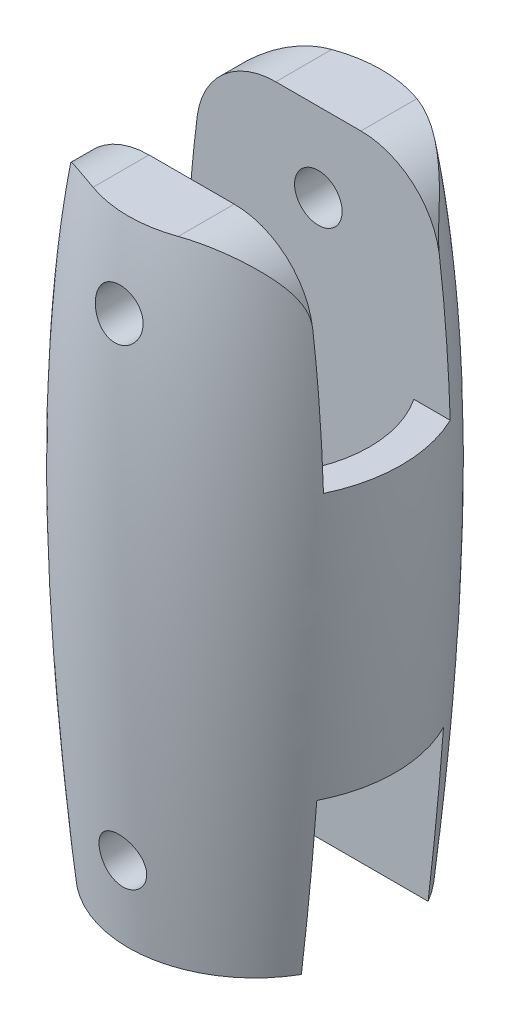
from build123d import *

# Parameters (mm, degrees)
CUT_EXTRUDE1_DEPTH      = 24.938835821
CUT_EXTRUDE1_DEPTH_BACK = 24.938835821
SKETCH2_W               = 8
SKETCH2_H               = 13
SKETCH2_H_2             = 10
CUT_EXTRUDE2_DEPTH      = 24.938835821
CUT_EXTRUDE2_DEPTH_BACK = 24.938835821
SKETCH3_R               = 1.5
CUT_EXTRUDE3_DEPTH      = 31.03444459
CUT_EXTRUDE4_START      = 10
CUT_EXTRUDE4_DEPTH      = 20


with BuildPart() as part:
    # Sketch1 → Revolve1 (revolve)
    with BuildSketch(Plane(origin=(0, 0, 0), x_dir=(0, 0, -1), z_dir=(1, 0, 0))):
        with BuildLine():
            Line((0, 20), (0, -20))
            Line((0, -20), (8, -20))
            add(Edge.make_bspline(
                [(8, 20), (10.604722665, 5.227883705), (8, -20)],
                knots=[0, 0, 0, 1, 1, 1], degree=2))
            Line((8, 20), (0, 20))
        make_face()
    revolve(axis=Axis((0, 20, 0), (0, -1, 0)))

    # Sketch2 → Cut-Extrude1 (cut, two sides: drawn at the far end of the back side and taken through both)
    with BuildSketch(Plane(origin=(0, 0, 0), x_dir=(0, 0, -1), z_dir=(1, 0, 0)).offset(-CUT_EXTRUDE1_DEPTH_BACK)):
        with Locations((0, 13.5)):
            Rectangle(SKETCH2_W, SKETCH2_H)
        with Locations((0, -15)):
            Rectangle(SKETCH2_W, SKETCH2_H_2)
    extrude(amount=CUT_EXTRUDE1_DEPTH + CUT_EXTRUDE1_DEPTH_BACK, mode=Mode.SUBTRACT)

    # Sketch3 → Cut-Extrude2 (cut, two sides: drawn at the far end of the back side and taken through both)
    with BuildSketch(Plane.XY.offset(-CUT_EXTRUDE2_DEPTH_BACK)):
        with Locations(Location((0, 15, 0), (0, 0, 270))):
            Circle(SKETCH3_R)
        with Locations(Location((0, -15, 0), (0, 0, 270))):
            Circle(SKETCH3_R)
    extrude(amount=CUT_EXTRUDE2_DEPTH + CUT_EXTRUDE2_DEPTH_BACK, mode=Mode.SUBTRACT)

    # Sketch4 → Cut-Extrude3 (cut, through all)
    with BuildSketch(Plane(origin=(0, 7, 0), x_dir=(1, 0, 0), z_dir=(0, 1, 0))):
        with BuildLine():
            ThreePointArc((-6.953963186, -2), (-6.568413105, -3.035383546), (-6.029726693, -4))
            Line((-6.029726693, -4), (6.029726693, -4))
            ThreePointArc((6.029726693, -4), (6.568413105, -3.035383546), (6.953963186, -2))
            ThreePointArc((6.953963186, -2), (7.165035811, -1.009884058), (7.235855443, 0))
            ThreePointArc((7.235855443, 0), (7.165035811, 1.009884058), (6.953963186, 2))
            ThreePointArc((6.953963186, 2), (6.568413105, 3.035383546), (6.029726693, 4))
            Line((6.029726693, 4), (-6.029726693, 4))
            ThreePointArc((-6.029726693, 4), (-6.568413105, 3.035383546), (-6.953963186, 2))
            ThreePointArc((-6.953963186, 2), (-7.235855443, 0), (-6.953963186, -2))
        make_face()
    extrude(amount=-CUT_EXTRUDE3_DEPTH, mode=Mode.SUBTRACT)

    # Sketch5 → Cut-Extrude4 (cut)
    with BuildSketch(Plane.XY.offset(CUT_EXTRUDE4_START)):
        with BuildLine():
            add(Edge.make_bspline(
                [(7.646286491, 15.644106168), (7.456972641, 17.101447086), (7.222625963, 18.553950368), (6.92820323, 20)],
                knots=[0.662887704, 0.662887704, 0.662887704, 0.662887704, 1, 1, 1, 1], degree=3))
            Line((6.92820323, 20), (2.687947329, 20))
            ThreePointArc((2.687947329, 20), (5.987907114, 18.756363324), (7.646286491, 15.644106168))
        make_face()
        with BuildLine():
            ThreePointArc((-7.646286491, 15.644106168), (-5.987907114, 18.756363324), (-2.687947329, 20))
            Line((-2.687947329, 20), (-6.92820323, 20))
            add(Edge.make_bspline(
                [(-6.92820323, 20), (-7.222625963, 18.553950368), (-7.456972641, 17.101447086), (-7.646286491, 15.644106168)],
                knots=[0, 0, 0, 0, 0.337112296, 0.337112296, 0.337112296, 0.337112296], degree=3))
        make_face()
    extrude(amount=-CUT_EXTRUDE4_DEPTH, mode=Mode.SUBTRACT)


solid = part.part
